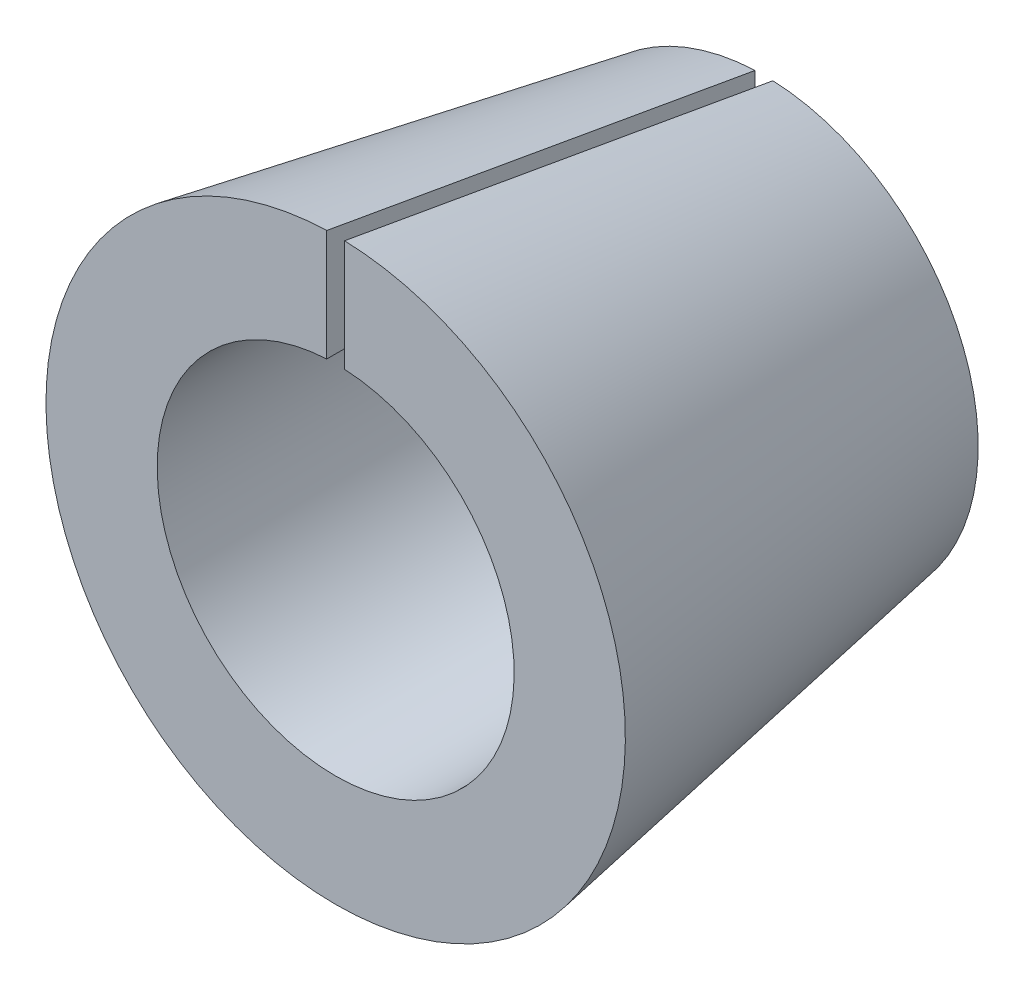
from build123d import *

# Parameters (mm, degrees)
CUT_EXTRUDE1_REACH = 18.605
SKETCH2_W          = 0.5
SKETCH2_H          = 8.115923769


with BuildPart() as part:
    # Sketch1 → Revolve1 (revolve)
    with BuildSketch(Plane(origin=(0, 0, 0), x_dir=(0, 0, -1), z_dir=(1, 0, 0)), mode=Mode.PRIVATE) as revolve1_sk:
        Polygon((0, 8.115923769), (0, 5), (12, 5), (12, 6), align=None)
    revolve(revolve1_sk.sketch.rotate(Axis((0, 0, -14.189132044), (0, 0, 1)), 90), axis=Axis((0, 0, -14.189132044), (0, 0, 1)))

    # Sketch2 → Cut-Extrude1 (cut, up to next)
    with BuildSketch(Plane.XY, mode=Mode.PRIVATE) as cut_extrude1_sk1:
        with Locations((0, 4.057961885)):
            Rectangle(SKETCH2_W, SKETCH2_H)
    cut_extrude1_tool1 = extrude(cut_extrude1_sk1.sketch, amount=-CUT_EXTRUDE1_REACH, mode=Mode.PRIVATE) & part.part
    add(cut_extrude1_tool1.solids().sort_by_distance((0, 4.057962, 0))[0], mode=Mode.SUBTRACT)


solid = part.part
